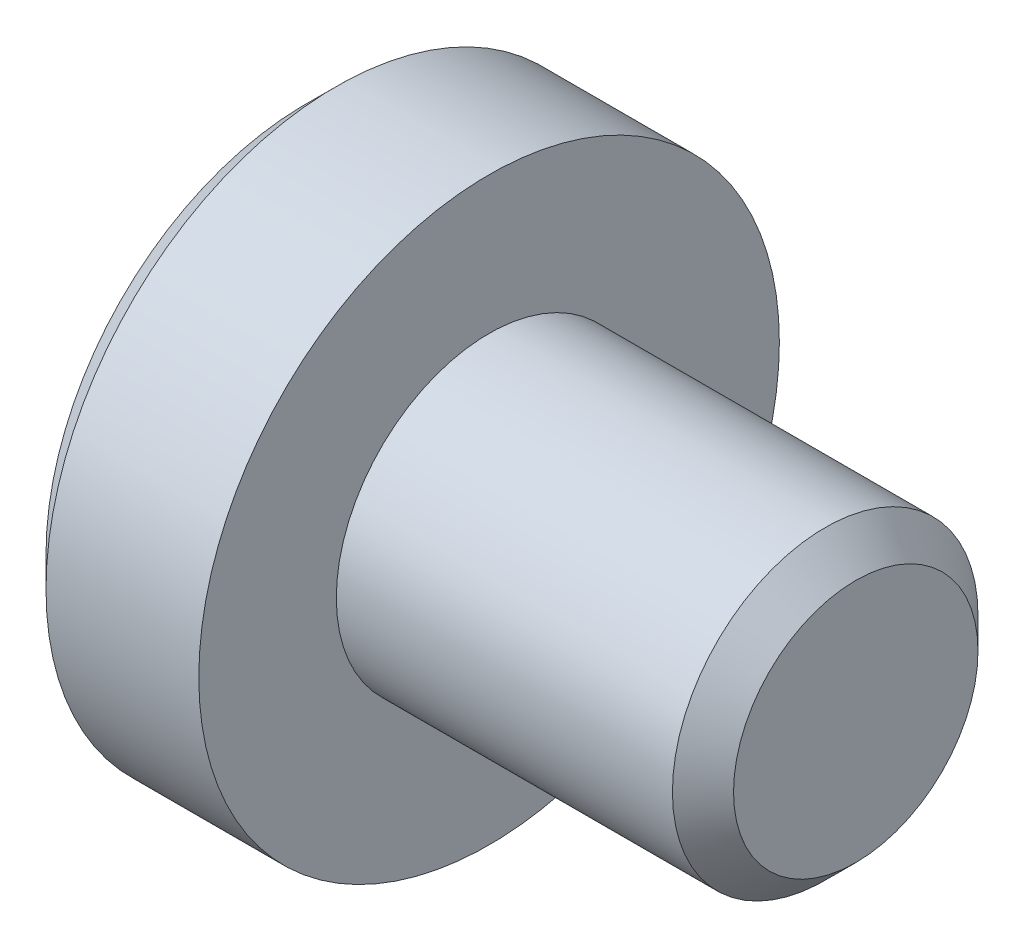
from build123d import *

# Parameters (mm, degrees)
CUT_EXTRUDE1_DEPTH = 2.75
CHAMFER1_SIZE      = 0.5
CHAMFER2_SIZE      = 0.5


with BuildPart() as part:
    # Sketch1 → Revolve1 (revolve)
    with BuildSketch(Plane.XY, mode=Mode.PRIVATE) as revolve1_sk:
        Polygon((0, 0), (0, 4.75), (3, 4.75), (3, 2.5), (9, 2.5), (9, 0), align=None)
    revolve(revolve1_sk.sketch.rotate(Axis((9, 0, 0), (-1, 0, 0)), 90), axis=Axis((9, 0, 0), (-1, 0, 0)))

    # Sketch2 → Cut-Extrude1 (cut)
    with BuildSketch(Plane.ZY):
        Polygon((0, 2.309401077), (-2, 1.154700538), (-2, -1.154700538), (0, -2.309401077), (2, -1.154700538), (2, 1.154700538), align=None)
    extrude(amount=-CUT_EXTRUDE1_DEPTH, mode=Mode.SUBTRACT)

    # Chamfer1
    chamfer1_edges = [part.edges().sort_by_distance(p)[0] for p in [
        (9, 0, 2.5),
    ]]
    chamfer(chamfer1_edges, length=CHAMFER1_SIZE)

    # Chamfer2
    chamfer2_edges = [part.edges().sort_by_distance(p)[0] for p in [
        (0, 0, 4.75),
    ]]
    chamfer(chamfer2_edges, length=CHAMFER2_SIZE)


solid = part.part
